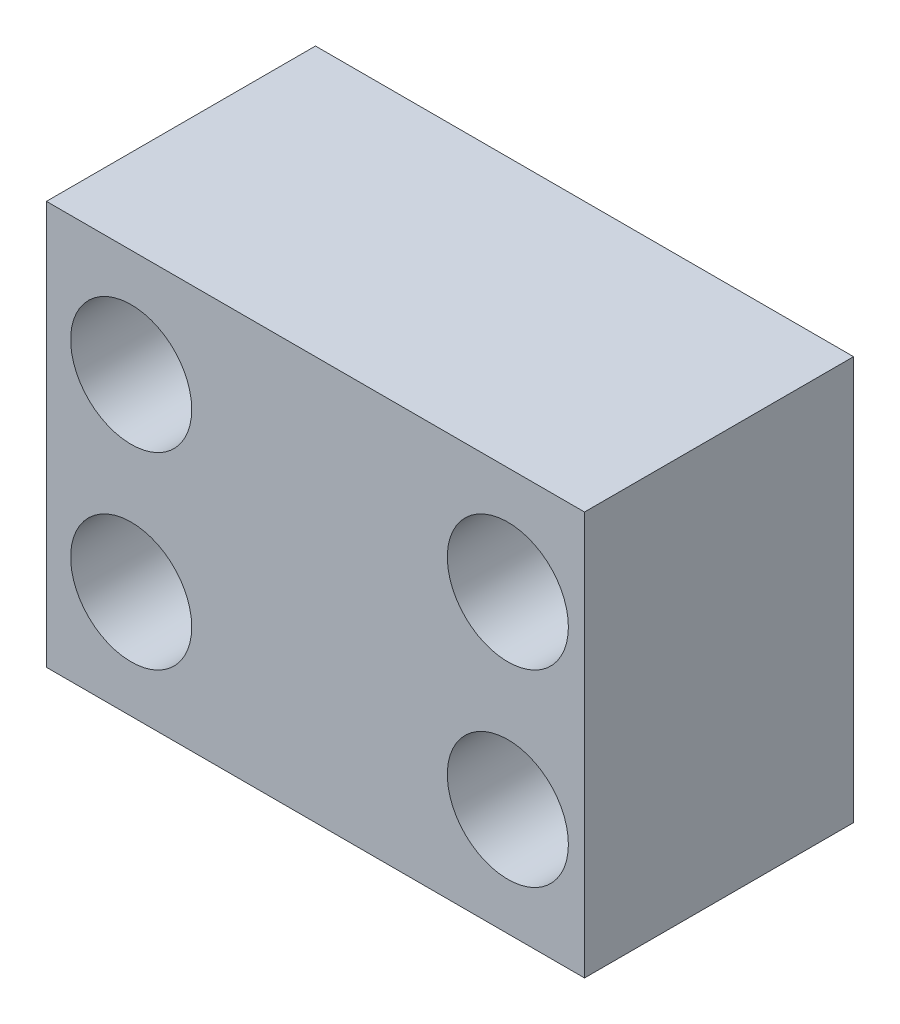
from build123d import *

# Parameters (mm, degrees)
SKETCH1_W           = 200
SKETCH1_H           = 150
BOSS_EXTRUDE1_DEPTH = 100
SKETCH2_R           = 22.5
CUT_EXTRUDE1_DEPTH  = 100


with BuildPart() as part:
    # Sketch1 → Boss-Extrude1 (new body)
    with BuildSketch(Plane.XY):
        Rectangle(SKETCH1_W, SKETCH1_H)
    extrude(amount=BOSS_EXTRUDE1_DEPTH)

    # Sketch2 → Cut-Extrude1 (cut)
    with BuildSketch(Plane.XY.offset(100)):
        with Locations((-68.5, 35)):
            Circle(SKETCH2_R)
        with Locations((-68.5, -35)):
            Circle(SKETCH2_R)
        with Locations((71.5, 35)):
            Circle(SKETCH2_R)
        with Locations((71.5, -35)):
            Circle(SKETCH2_R)
    extrude(amount=-CUT_EXTRUDE1_DEPTH, mode=Mode.SUBTRACT)


solid = part.part
